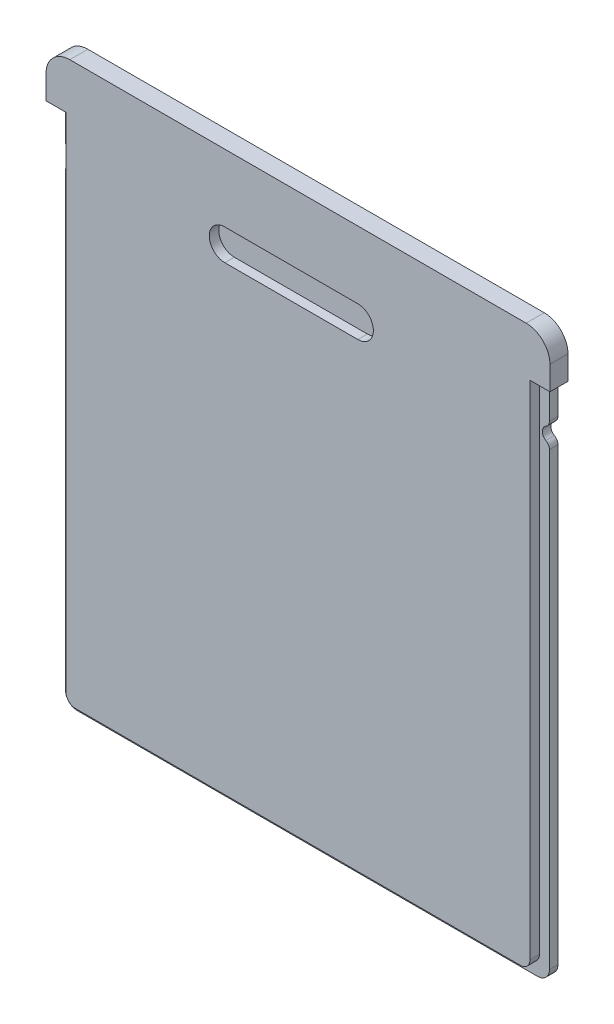
from build123d import *

# Parameters (mm, degrees)
BOSS_EXTRUDE1_DEPTH = 1.8
BOSS_EXTRUDE2_DEPTH = 2
CUT_EXTRUDE1_DEPTH  = 2
SKETCH5_R           = 1.5
CUT_EXTRUDE2_DEPTH  = 1.8
FILLET3_R           = 1.5
FILLET4_R           = 5


with BuildPart() as part:
    # Sketch1 → Boss-Extrude1 (new body)
    with BuildSketch(Plane.XY):
        with BuildLine():
            Line((101.8, 109.8), (103.9, 109.8))
            Line((103.9, 109.8), (103.9, 119.8))
            Line((103.9, 119.8), (-2.1, 119.8))
            Line((-2.1, 119.8), (-2.1, 109.8))
            Line((-2.1, 109.8), (0, 109.8))
            Line((0, 109.8), (0, 2.5))
            ThreePointArc((0, 2.5), (0.732233047, 0.732233047), (2.5, 0))
            Line((2.5, 0), (99.3, 0))
            ThreePointArc((99.3, 0), (101.067766953, 0.732233047), (101.8, 2.5))
            Line((101.8, 2.5), (101.8, 109.8))
        make_face()
    extrude(amount=BOSS_EXTRUDE1_DEPTH)

    # Sketch2 → Boss-Extrude2 (add)
    with BuildSketch(Plane.XY.offset(1.8)):
        with BuildLine():
            Line((2.1, 109.8), (2.1, 4.2))
            ThreePointArc((2.1, 4.2), (2.685786438, 2.785786438), (4.1, 2.2))
            Line((4.1, 2.2), (97.7, 2.2))
            ThreePointArc((97.7, 2.2), (99.114213562, 2.785786438), (99.7, 4.2))
            Line((99.7, 4.2), (99.7, 109.8))
            Line((99.7, 109.8), (103.9, 109.8))
            Line((103.9, 109.8), (103.9, 119.8))
            Line((103.9, 119.8), (-2.1, 119.8))
            Line((-2.1, 119.8), (-2.1, 109.8))
            Line((-2.1, 109.8), (2.1, 109.8))
        make_face()
    extrude(amount=BOSS_EXTRUDE2_DEPTH)

    # Sketch3 → Cut-Extrude1 (cut)
    with BuildSketch(Plane.XY.offset(3.8)):
        with BuildLine():
            Line((35.496856475, 105.630553179), (63.503143525, 105.630553179))
            ThreePointArc((63.503143525, 105.630553179), (66.759688531, 102.374008173), (63.503143525, 99.117463168))
            Line((63.503143525, 99.117463168), (35.496856475, 99.117463168))
            ThreePointArc((35.496856475, 99.117463168), (32.240311469, 102.374008173), (35.496856475, 105.630553179))
        make_face()
    extrude(amount=-CUT_EXTRUDE1_DEPTH, mode=Mode.SUBTRACT)

    # Sketch5 → Cut-Extrude2 (cut)
    with BuildSketch(Plane(origin=(0, 0, 0), x_dir=(-1, 0, 0), z_dir=(0, 0, -1))):
        with Locations((-101.8, 99.8)):
            Circle(SKETCH5_R)
        with Locations((0, 99.8)):
            Circle(SKETCH5_R)
    extrude(amount=-CUT_EXTRUDE2_DEPTH, mode=Mode.SUBTRACT)

    # Fillet3
    fillet3_edges = [part.edges().sort_by_distance(p)[0] for p in [
        (101.8, 101.3, 0.9),
        (101.8, 98.3, 0.9),
        (0, 98.3, 0.9),
        (0, 101.3, 0.9),
    ]]
    fillet(fillet3_edges, radius=FILLET3_R)

    # Fillet4
    fillet4_edges = [part.edges().sort_by_distance(p)[0] for p in [
        (-2.1, 119.8, 1.9),
        (103.9, 119.8, 1.9),
    ]]
    fillet(fillet4_edges, radius=FILLET4_R)


solid = part.part
